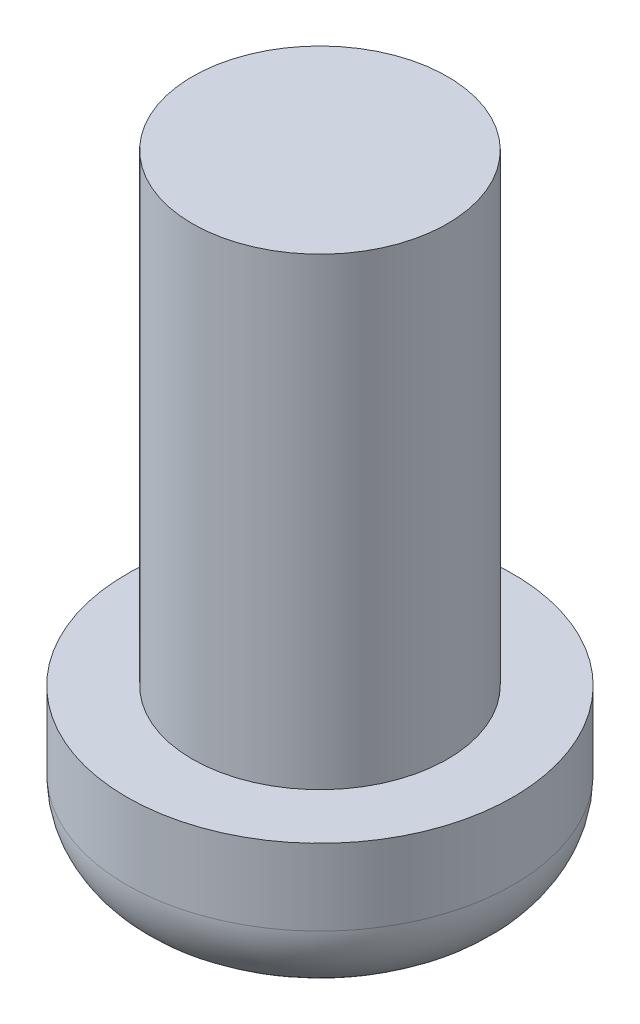
from build123d import *

# Parameters (mm, degrees)
SKETCH1_R           = 2.5
BOSS_EXTRUDE1_DEPTH = 2
SKETCH2_R           = 1.65
BOSS_EXTRUDE2_DEPTH = 6
FILLET1_R           = 1.016


with BuildPart() as part:
    # Sketch1 → Boss-Extrude1 (new body)
    with BuildSketch(Plane(origin=(0, 0, 0), x_dir=(1, 0, 0), z_dir=(0, 1, 0))):
        with Locations(Location((0, 0, 0), (0, 0, 270))):
            Circle(SKETCH1_R)
    extrude(amount=BOSS_EXTRUDE1_DEPTH)

    # Sketch2 → Boss-Extrude2 (add)
    with BuildSketch(Plane(origin=(0, 2, 0), x_dir=(1, 0, 0), z_dir=(0, 1, 0))):
        with Locations(Location((0, 0, 0), (0, 0, 270))):
            Circle(SKETCH2_R)
    extrude(amount=BOSS_EXTRUDE2_DEPTH)

    # Fillet1
    fillet1_edges = [part.edges().sort_by_distance(p)[0] for p in [
        (0, 0, -2.5),
    ]]
    fillet(fillet1_edges, radius=FILLET1_R)


solid = part.part
